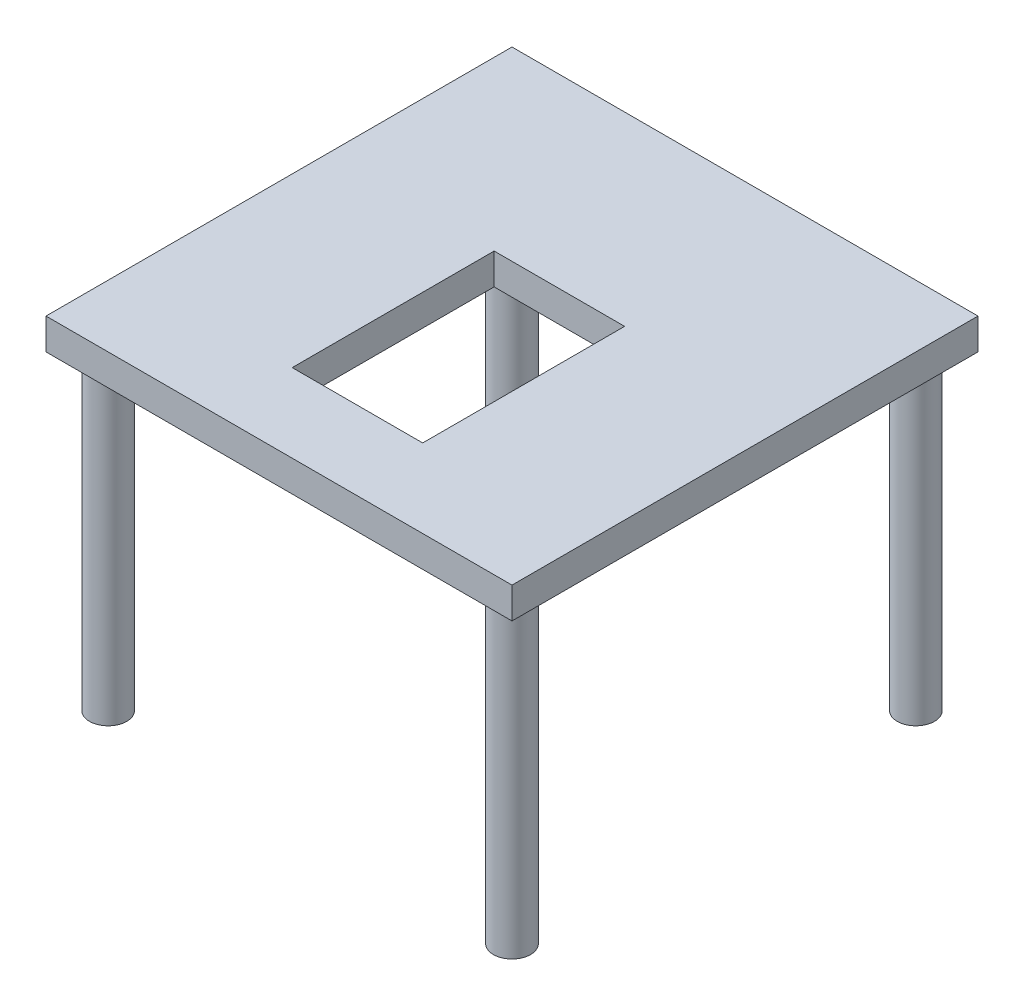
from build123d import *

# Parameters (mm, degrees)
SKETCH1_W           = 150
SKETCH1_H           = 150
BOSS_EXTRUDE2_DEPTH = 10
BOSS_EXTRUDE3_DEPTH = 100
SKETCH4_W           = 42
SKETCH4_H           = 65
CUT_EXTRUDE1_DEPTH  = 153.807067899


with BuildPart() as part:
    # Sketch1 → Boss-Extrude2 (new body)
    with BuildSketch(Plane(origin=(0, 0, 0), x_dir=(1, 0, 0), z_dir=(0, 1, 0))):
        Rectangle(SKETCH1_W, SKETCH1_H)
    extrude(amount=BOSS_EXTRUDE2_DEPTH)

    # Sketch3 → Boss-Extrude3 (add)
    with BuildSketch(Plane.XZ):
        with BuildLine():
            ThreePointArc((-59, 65), (-69.242640687, 69.242640687), (-65, 59))
            Line((-65, 59), (-65, 65))
            Line((-65, 65), (-59, 65))
        make_face()
        with BuildLine():
            Line((-65, 65), (-65, 59))
            ThreePointArc((-65, 59), (-60.757359313, 60.757359313), (-59, 65))
            Line((-59, 65), (-65, 65))
        make_face()
        with BuildLine():
            ThreePointArc((59, 65), (60.757359313, 60.757359313), (65, 59))
            Line((65, 59), (65, 65))
            Line((65, 65), (59, 65))
        make_face()
        with BuildLine():
            Line((65, 65), (65, 59))
            ThreePointArc((65, 59), (69.242640687, 60.757359313), (71, 65))
            ThreePointArc((71, 65), (65, 71), (59, 65))
            Line((59, 65), (65, 65))
        make_face()
        with BuildLine():
            ThreePointArc((59, 65), (60.757359313, 60.757359313), (65, 59))
            Line((65, 59), (65, 65))
            Line((65, 65), (59, 65))
        make_face()
        with BuildLine():
            Line((65, 65), (65, 59))
            ThreePointArc((65, 59), (69.242640687, 60.757359313), (71, 65))
            ThreePointArc((71, 65), (65, 71), (59, 65))
            Line((59, 65), (65, 65))
        make_face()
        with BuildLine():
            ThreePointArc((-59, 65), (-69.242640687, 69.242640687), (-65, 59))
            Line((-65, 59), (-65, 65))
            Line((-65, 65), (-59, 65))
        make_face()
        with BuildLine():
            Line((-65, 65), (-65, 59))
            ThreePointArc((-65, 59), (-60.757359313, 60.757359313), (-59, 65))
            Line((-59, 65), (-65, 65))
        make_face()
        with BuildLine():
            Line((-65, -59), (-65, -65))
            Line((-65, -65), (-59, -65))
            ThreePointArc((-59, -65), (-60.757359313, -60.757359313), (-65, -59))
        make_face()
        with BuildLine():
            Line((-59, -65), (-65, -65))
            Line((-65, -65), (-65, -59))
            ThreePointArc((-65, -59), (-69.242640687, -69.242640687), (-59, -65))
        make_face()
        with BuildLine():
            Line((-65, -59), (-65, -65))
            Line((-65, -65), (-59, -65))
            ThreePointArc((-59, -65), (-60.757359313, -60.757359313), (-65, -59))
        make_face()
        with BuildLine():
            Line((-59, -65), (-65, -65))
            Line((-65, -65), (-65, -59))
            ThreePointArc((-65, -59), (-69.242640687, -69.242640687), (-59, -65))
        make_face()
        with BuildLine():
            ThreePointArc((65, -59), (60.757359313, -60.757359313), (59, -65))
            Line((59, -65), (65, -65))
            Line((65, -65), (65, -59))
        make_face()
        with BuildLine():
            Line((65, -65), (59, -65))
            ThreePointArc((59, -65), (65, -71), (71, -65))
            ThreePointArc((71, -65), (69.242640687, -60.757359313), (65, -59))
            Line((65, -59), (65, -65))
        make_face()
        with BuildLine():
            ThreePointArc((65, -59), (60.757359313, -60.757359313), (59, -65))
            Line((59, -65), (65, -65))
            Line((65, -65), (65, -59))
        make_face()
        with BuildLine():
            Line((65, -65), (59, -65))
            ThreePointArc((59, -65), (65, -71), (71, -65))
            ThreePointArc((71, -65), (69.242640687, -60.757359313), (65, -59))
            Line((65, -59), (65, -65))
        make_face()
    extrude(amount=BOSS_EXTRUDE3_DEPTH)

    # Sketch4 → Cut-Extrude1 (cut, through all)
    with BuildSketch(Plane(origin=(0, 10, 0), x_dir=(1, 0, 0), z_dir=(0, 1, 0))):
        with Locations((0, -17.25)):
            Rectangle(SKETCH4_W, SKETCH4_H)
    extrude(amount=-CUT_EXTRUDE1_DEPTH, mode=Mode.SUBTRACT)


solid = part.part
